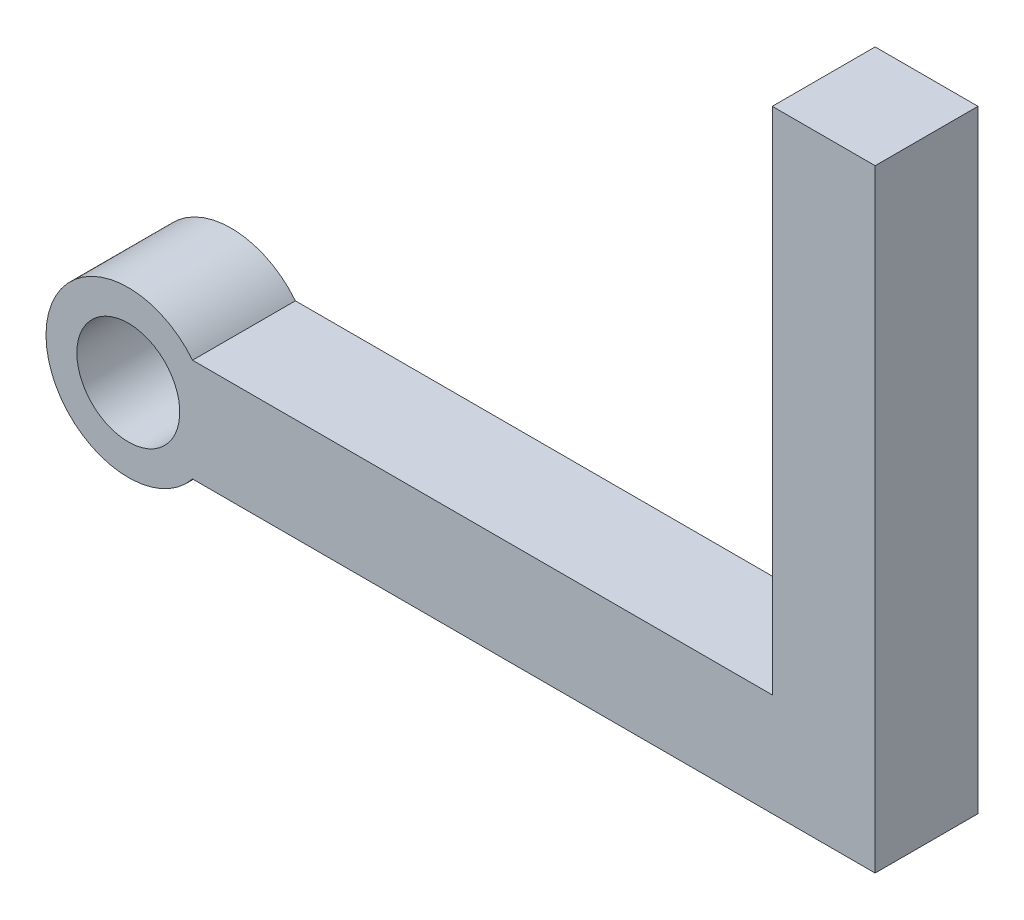
from build123d import *

# Parameters (mm, degrees)
SKETCH1_W                  = 85.852
SKETCH1_H                  = 12.7
BOSS_EXTRUDE1_DEPTH        = 12.7
SKETCH9_W                  = 12.7
SKETCH9_H                  = 12.7
BOSS_EXTRUDE2_DEPTH        = 62.933072
SKETCH10_R                 = 10.16
BOSS_EXTRUDE3_DEPTH        = 12.7
F_1_2_0_5_DIAMETER_HOLE1_D = 12.7


with BuildPart() as part:
    # Sketch1 → Boss-Extrude1 (new body)
    with BuildSketch(Plane(origin=(0, 0, 0), x_dir=(1, 0, 0), z_dir=(0, 1, 0))):
        with Locations((0, 38.1)):
            Rectangle(SKETCH1_W, SKETCH1_H)
    extrude(amount=BOSS_EXTRUDE1_DEPTH)

    # Sketch9 → Boss-Extrude2 (add)
    with BuildSketch(Plane(origin=(0, 12.7, 0), x_dir=(1, 0, 0), z_dir=(0, 1, 0))):
        with Locations((36.576, 38.1)):
            Rectangle(SKETCH9_W, SKETCH9_H)
    extrude(amount=BOSS_EXTRUDE2_DEPTH)

    # Sketch10 → Boss-Extrude3 (add)
    with BuildSketch(Plane(origin=(0, 0, -44.45), x_dir=(-1, 0, 0), z_dir=(0, 0, -1))):
        with Locations((49.276, 6.35)):
            Circle(SKETCH10_R)
    extrude(amount=-BOSS_EXTRUDE3_DEPTH)

    # 1/2 (0.5) Diameter Hole1 (through all)
    with Locations(Plane(origin=(-49.276, 6.35, -44.45), x_dir=(-1, 0, 0), z_dir=(0, 0, -1))):
        with Locations((0, 0)):
            Hole(F_1_2_0_5_DIAMETER_HOLE1_D / 2)


solid = part.part
